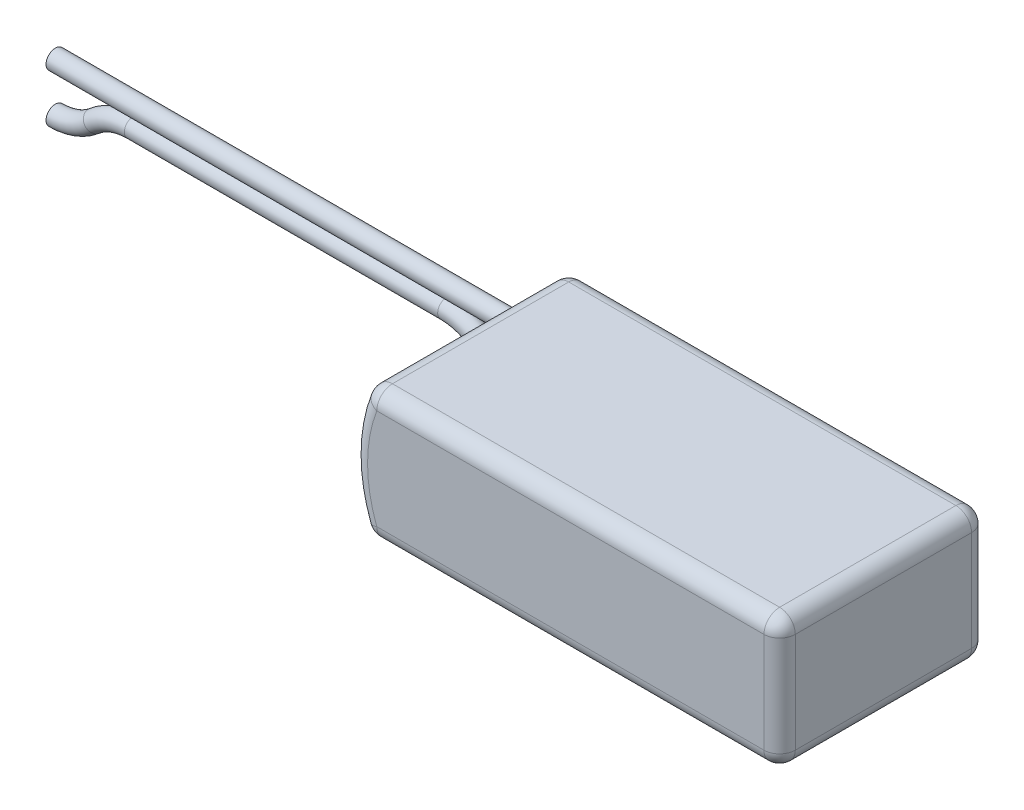
from build123d import *
from build123d.topology import SkipClean

# Parameters (mm, degrees)
SKETCH1_W               = 69.342
SKETCH1_H               = 33.655
BOSS_EXTRUDE1_DEPTH     = 21.336
CUT_EXTRUDE2_DEPTH      = 53.820092408
CUT_EXTRUDE2_DEPTH_BACK = 53.820092408
FILLET1_R               = 2.54
SKETCH3_R               = 1.524
BOSS_EXTRUDE2_DEPTH     = 3.81
SKETCH5_R               = 1.524
SKETCH5_3_R             = 1.524


with BuildPart() as part:
    # Sketch1 → Boss-Extrude1 (new body)
    with BuildSketch(Plane(origin=(0, 0, 0), x_dir=(1, 0, 0), z_dir=(0, 1, 0))):
        Rectangle(SKETCH1_W, SKETCH1_H)
    extrude(amount=BOSS_EXTRUDE1_DEPTH)

    # Sketch2 → Cut-Extrude2 (cut, two sides: drawn at the far end of the back side and taken through both)
    with BuildSketch(Plane.XY.offset(16.8275).offset(-CUT_EXTRUDE2_DEPTH_BACK)):
        with BuildLine():
            Line((30.937128183, 158.024775042), (-32.322112251, 21.336))
            ThreePointArc((-32.322112251, 21.336), (-34.671, 10.668), (-32.322112251, 0))
            Line((-32.322112251, 0), (30.937128183, -136.688775042))
            Line((30.937128183, -136.688775042), (-270.297350074, -136.688775042))
            Line((-270.297350074, -136.688775042), (-270.297350074, 158.024775042))
            Line((-270.297350074, 158.024775042), (30.937128183, 158.024775042))
        make_face()
    extrude(amount=CUT_EXTRUDE2_DEPTH + CUT_EXTRUDE2_DEPTH_BACK, mode=Mode.SUBTRACT)

    # Fillet1
    fillet1_edges = [part.edges().sort_by_distance(p)[0] for p in [
        (34.671, 21.336, 0),
        (1.174443875, 21.336, -16.8275),
        (1.174443875, 0, 16.8275),
        (-32.322112251, 0, 0),
        (1.174443875, 21.336, 16.8275),
        (-32.322112251, 21.336, 0),
        (-34.671, 10.668, 16.8275),
        (-34.671, 10.668, -16.8275),
        (1.174443875, 0, -16.8275),
        (34.671, 0, 0),
        (34.671, 10.668, -16.8275),
        (34.671, 10.668, 16.8275),
    ]]
    fillet(fillet1_edges, radius=FILLET1_R)

    # Sketch3 → Boss-Extrude2 (add)
    with BuildSketch(Plane.ZY.offset(32.322112251)):
        with Locations(Location((-12.7635, 12.56538, 0), (0, 0, 180))):
            Circle(SKETCH3_R)
        with Locations(Location((-12.7635, 4.699, 0), (0, 0, 180))):
            Circle(SKETCH3_R)
    extrude(amount=BOSS_EXTRUDE2_DEPTH)

    # Sweep1: sweep along a path in Sketch4
    with SkipClean():  # the faces are left unmerged after this step: merging them gives an invalid solid
        with BuildLine(Plane.XY.offset(-12.7635)) as sweep1_path:
            Line((-36.132112251, 12.56538), (-48.832112251, 12.56538))
            Line((-48.832112251, 12.56538), (-112.332112251, 12.56538))
        # Sketch5 → Sweep1 (sweep)
        with BuildSketch(Plane.ZY.offset(36.132112251)):
            with Locations((-12.7635, 12.56538)):
                Circle(SKETCH5_R)
        sweep(path=sweep1_path.line)

    # Sweep2: sweep along a path in Sketch4<3>
    with SkipClean():  # the faces are left unmerged after this step: merging them gives an invalid solid
        with BuildLine(Plane.XY.offset(-12.7635)) as sweep2_path:
            ThreePointArc((-36.132112251, 4.699), (-39.516811705, 5.304169163), (-42.482112251, 7.04469))
            ThreePointArc((-42.482112251, 7.04469), (-45.447412797, 8.785210837), (-48.832112251, 9.39038))
            Line((-48.832112251, 9.39038), (-99.632112251, 9.39038))
            ThreePointArc((-99.632112251, 9.39038), (-103.016811705, 8.785210837), (-105.982112251, 7.04469))
            ThreePointArc((-105.982112251, 7.04469), (-108.947412797, 5.304169163), (-112.332112251, 4.699))
        # Sketch5<3> → Sweep2 (sweep)
        with BuildSketch(Plane.ZY.offset(36.132112251)):
            with Locations((-12.7635, 4.699)):
                Circle(SKETCH5_3_R)
        sweep(path=sweep2_path.line)


solid = part.part
